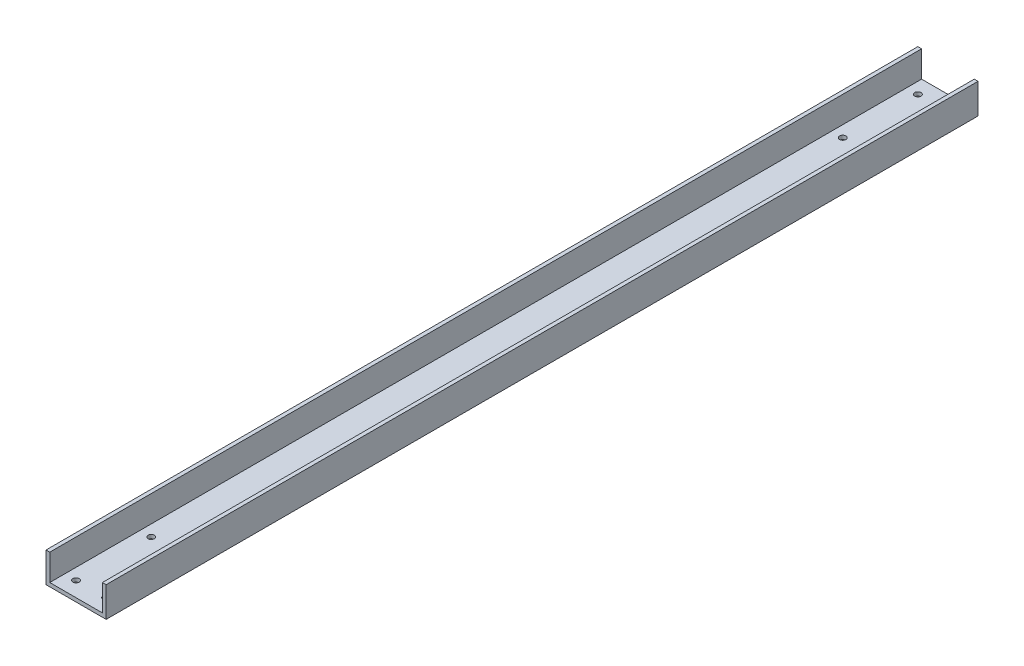
from build123d import *

# Parameters (mm, degrees)
EXTRUDE_F_DEPTH    = 736.6
CUT_EXTRUDE1_REACH = 740.684
SKETCH2_R          = 2.667


with BuildPart() as part:
    # Sketch1 → Extrude f (new body)
    with BuildSketch(Plane.XY):
        Polygon((3.175, 3.175), (3.175, 25.4), (0, 25.4), (0, 0), (50.8, 0), (50.8, 25.4), (47.625, 25.4), (47.625, 3.175), align=None)
    extrude(amount=EXTRUDE_F_DEPTH)

    # Sketch2 → Cut-Extrude1 (cut, up to next)
    with BuildSketch(Plane(origin=(0, 3.175, 0), x_dir=(1, 0, 0), z_dir=(0, 1, 0)), mode=Mode.PRIVATE) as cut_extrude1_sk1:
        with Locations(Location((12.7, -723.9, 0), (0, 0, 270))):
            Circle(SKETCH2_R)
    cut_extrude1_tool1 = extrude(cut_extrude1_sk1.sketch, amount=-CUT_EXTRUDE1_REACH, mode=Mode.PRIVATE) & part.part
    # Sketch2 → Cut-Extrude1 (cut, up to next)
    with BuildSketch(Plane(origin=(0, 3.175, 0), x_dir=(1, 0, 0), z_dir=(0, 1, 0)), mode=Mode.PRIVATE) as cut_extrude1_sk2:
        with Locations(Location((12.7, -660.4, 0), (0, 0, 270))):
            Circle(SKETCH2_R)
    cut_extrude1_tool2 = extrude(cut_extrude1_sk2.sketch, amount=-CUT_EXTRUDE1_REACH, mode=Mode.PRIVATE) & part.part
    # Sketch2 → Cut-Extrude1 (cut, up to next)
    with BuildSketch(Plane(origin=(0, 3.175, 0), x_dir=(1, 0, 0), z_dir=(0, 1, 0)), mode=Mode.PRIVATE) as cut_extrude1_sk3:
        with Locations(Location((38.1, -660.4, 0), (0, 0, 270))):
            Circle(SKETCH2_R)
    cut_extrude1_tool3 = extrude(cut_extrude1_sk3.sketch, amount=-CUT_EXTRUDE1_REACH, mode=Mode.PRIVATE) & part.part
    # Sketch2 → Cut-Extrude1 (cut, up to next)
    with BuildSketch(Plane(origin=(0, 3.175, 0), x_dir=(1, 0, 0), z_dir=(0, 1, 0)), mode=Mode.PRIVATE) as cut_extrude1_sk4:
        with Locations(Location((38.1, -723.9, 0), (0, 0, 270))):
            Circle(SKETCH2_R)
    cut_extrude1_tool4 = extrude(cut_extrude1_sk4.sketch, amount=-CUT_EXTRUDE1_REACH, mode=Mode.PRIVATE) & part.part
    # Sketch2 → Cut-Extrude1 (cut, up to next)
    with BuildSketch(Plane(origin=(0, 3.175, 0), x_dir=(1, 0, 0), z_dir=(0, 1, 0)), mode=Mode.PRIVATE) as cut_extrude1_sk5:
        with Locations(Location((38.1, -12.7, 0), (0, 0, 270))):
            Circle(SKETCH2_R)
    cut_extrude1_tool5 = extrude(cut_extrude1_sk5.sketch, amount=-CUT_EXTRUDE1_REACH, mode=Mode.PRIVATE) & part.part
    # Sketch2 → Cut-Extrude1 (cut, up to next)
    with BuildSketch(Plane(origin=(0, 3.175, 0), x_dir=(1, 0, 0), z_dir=(0, 1, 0)), mode=Mode.PRIVATE) as cut_extrude1_sk6:
        with Locations(Location((38.1, -76.2, 0), (0, 0, 270))):
            Circle(SKETCH2_R)
    cut_extrude1_tool6 = extrude(cut_extrude1_sk6.sketch, amount=-CUT_EXTRUDE1_REACH, mode=Mode.PRIVATE) & part.part
    # Sketch2 → Cut-Extrude1 (cut, up to next)
    with BuildSketch(Plane(origin=(0, 3.175, 0), x_dir=(1, 0, 0), z_dir=(0, 1, 0)), mode=Mode.PRIVATE) as cut_extrude1_sk7:
        with Locations(Location((12.7, -12.7, 0), (0, 0, 270))):
            Circle(SKETCH2_R)
    cut_extrude1_tool7 = extrude(cut_extrude1_sk7.sketch, amount=-CUT_EXTRUDE1_REACH, mode=Mode.PRIVATE) & part.part
    # Sketch2 → Cut-Extrude1 (cut, up to next)
    with BuildSketch(Plane(origin=(0, 3.175, 0), x_dir=(1, 0, 0), z_dir=(0, 1, 0)), mode=Mode.PRIVATE) as cut_extrude1_sk8:
        with Locations(Location((12.7, -76.2, 0), (0, 0, 270))):
            Circle(SKETCH2_R)
    cut_extrude1_tool8 = extrude(cut_extrude1_sk8.sketch, amount=-CUT_EXTRUDE1_REACH, mode=Mode.PRIVATE) & part.part
    add(cut_extrude1_tool1.solids().sort_by_distance((12.7, 3.175, 723.9))[0], mode=Mode.SUBTRACT)
    add(cut_extrude1_tool2.solids().sort_by_distance((12.7, 3.175, 660.4))[0], mode=Mode.SUBTRACT)
    add(cut_extrude1_tool3.solids().sort_by_distance((38.1, 3.175, 660.4))[0], mode=Mode.SUBTRACT)
    add(cut_extrude1_tool4.solids().sort_by_distance((38.1, 3.175, 723.9))[0], mode=Mode.SUBTRACT)
    add(cut_extrude1_tool5.solids().sort_by_distance((38.1, 3.175, 12.7))[0], mode=Mode.SUBTRACT)
    add(cut_extrude1_tool6.solids().sort_by_distance((38.1, 3.175, 76.2))[0], mode=Mode.SUBTRACT)
    add(cut_extrude1_tool7.solids().sort_by_distance((12.7, 3.175, 12.7))[0], mode=Mode.SUBTRACT)
    add(cut_extrude1_tool8.solids().sort_by_distance((12.7, 3.175, 76.2))[0], mode=Mode.SUBTRACT)


solid = part.part
